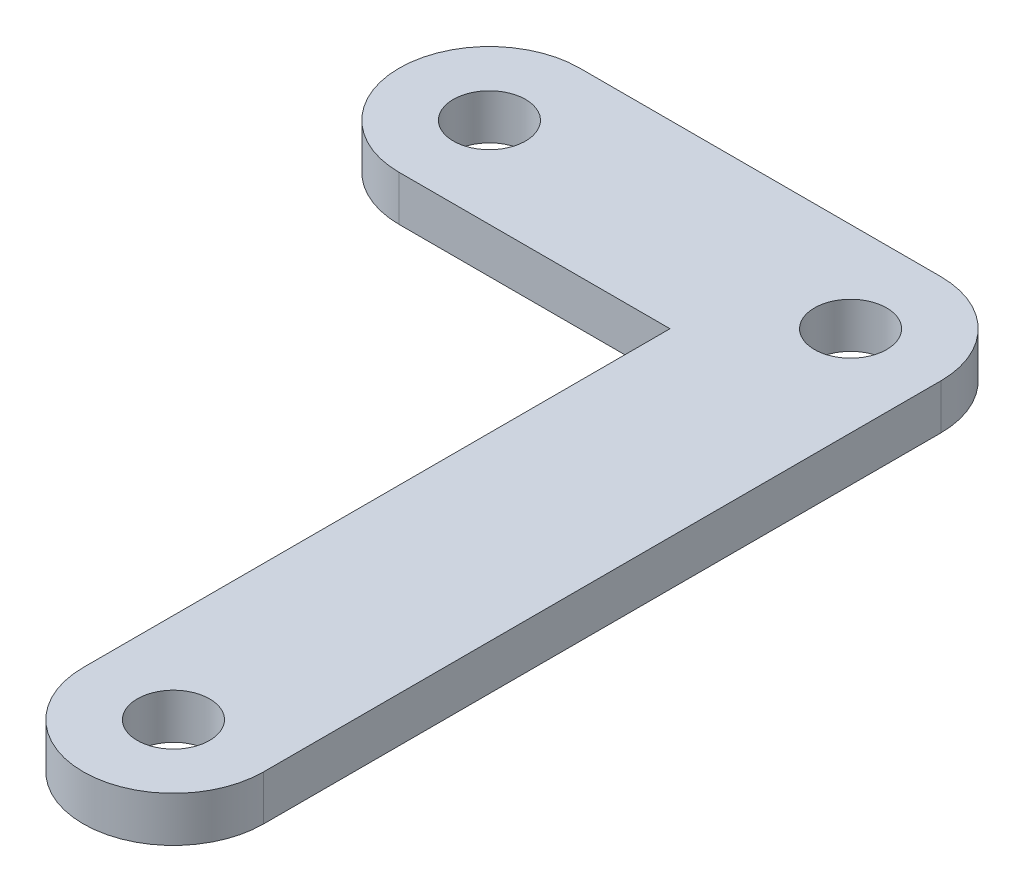
from build123d import *

# Parameters (mm, degrees)
BOSS_EXTRUDE1_DEPTH = 5
SKETCH2_R           = 4
CUT_EXTRUDE1_DEPTH  = 5


with BuildPart() as part:
    # Sketch1 → Boss-Extrude1 (new body)
    with BuildSketch(Plane(origin=(0, 0, 0), x_dir=(1, 0, 0), z_dir=(0, 1, 0))):
        with BuildLine():
            Line((-40, 85), (0, 85))
            ThreePointArc((0, 85), (7.071067812, 82.071067812), (10, 75))
            Line((10, 75), (10, 0))
            ThreePointArc((10, 0), (0, -10), (-10, 0))
            Line((-10, 0), (-10, 65))
            Line((-10, 65), (-40, 65))
            ThreePointArc((-40, 65), (-50, 75), (-40, 85))
        make_face()
    extrude(amount=BOSS_EXTRUDE1_DEPTH)

    # Sketch2 → Cut-Extrude1 (cut)
    with BuildSketch(Plane.XZ):
        Circle(SKETCH2_R)
        with Locations((-40, -75)):
            Circle(SKETCH2_R)
        with Locations((0, -75)):
            Circle(SKETCH2_R)
    extrude(amount=-CUT_EXTRUDE1_DEPTH, mode=Mode.SUBTRACT)


solid = part.part
